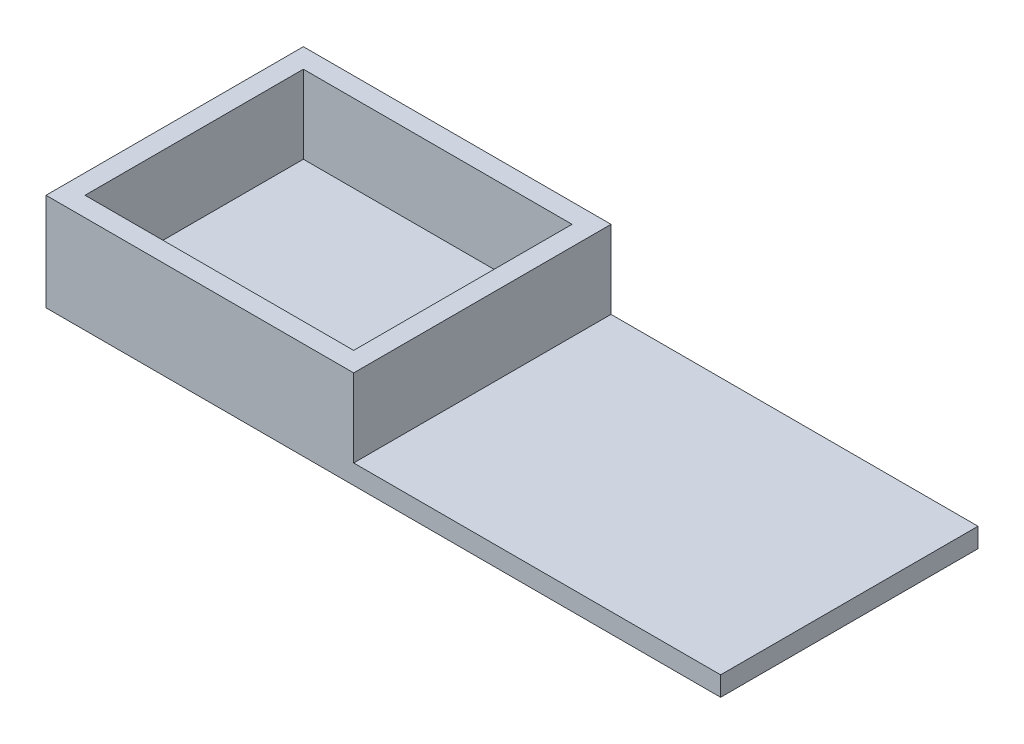
from build123d import *

# Parameters (mm, degrees)
SKETCH1_W           = 173
SKETCH1_H           = 66
BOSS_EXTRUDE1_DEPTH = 5
SKETCH3_W           = 78.9
SKETCH3_H           = 66
BOSS_EXTRUDE2_DEPTH = 20
SHELL1_T            = -5


with BuildPart() as part:
    # Sketch1 → Boss-Extrude1 (new body)
    with BuildSketch(Plane(origin=(0, 0, 0), x_dir=(1, 0, 0), z_dir=(0, 1, 0))):
        Rectangle(SKETCH1_W, SKETCH1_H)
    extrude(amount=BOSS_EXTRUDE1_DEPTH)

    # Sketch3 → Boss-Extrude2 (add)
    with BuildSketch(Plane(origin=(0, 5, 0), x_dir=(1, 0, 0), z_dir=(0, 1, 0))):
        with Locations((-47.05, 0)):
            Rectangle(SKETCH3_W, SKETCH3_H)
    extrude(amount=BOSS_EXTRUDE2_DEPTH)

    # Shell1
    shell1_openings = [part.faces().sort_by_distance(p)[0] for p in [
        (-47.05, 25, 0),
    ]]
    offset(amount=SHELL1_T, openings=shell1_openings, kind=Kind.INTERSECTION)


solid = part.part
